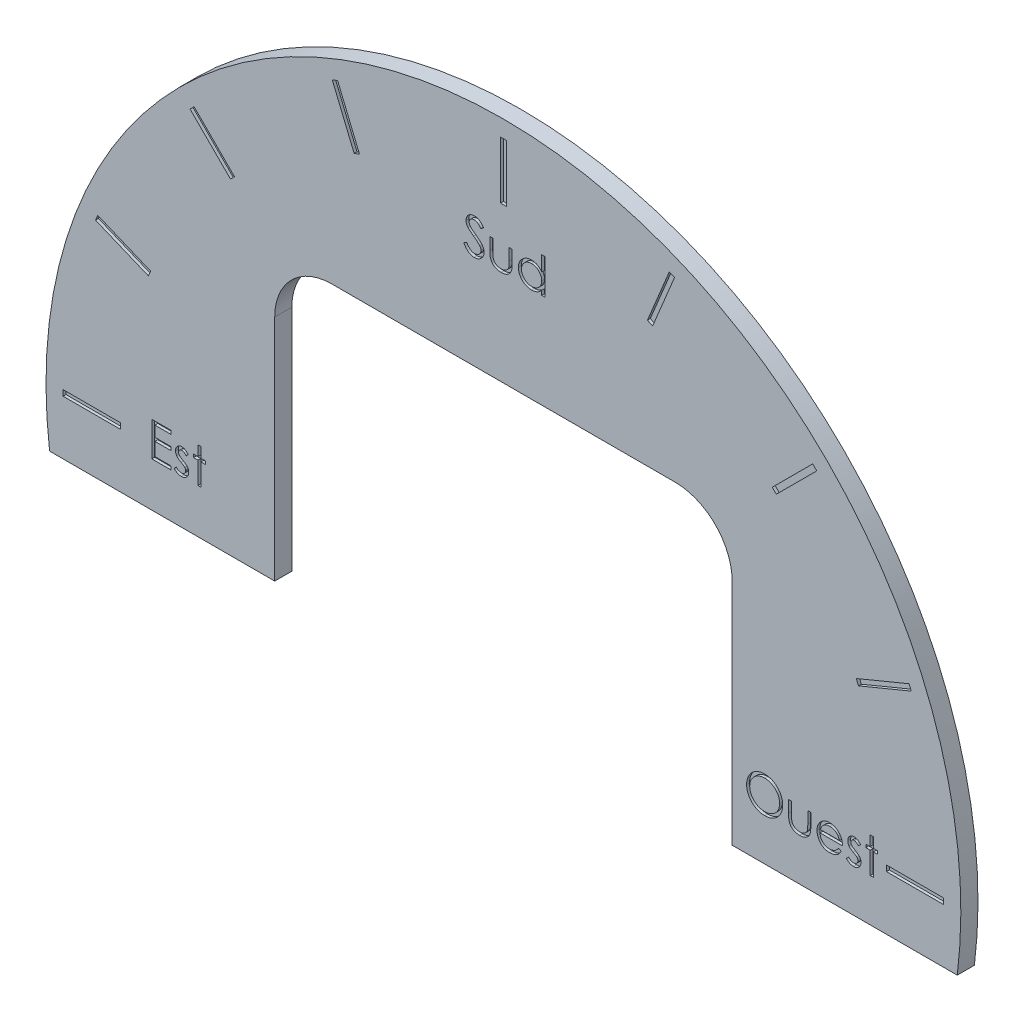
from build123d import *

# Parameters (mm, degrees)
BOSS_EXTRU_1_DEPTH      = 3
ESQUISSE2_W             = 10
ESQUISSE2_H             = 1
ESQUISSE2_W_2           = 1
ESQUISSE2_H_2           = 10
ENL_V_MAT_EXTRU_1_DEPTH = 0.5
ENL_V_MAT_EXTRU_2_DEPTH = 0.5


with BuildPart() as part:
    # Esquisse1 → Boss.-Extru.1 (new body)
    with BuildSketch(Plane.XY):
        with BuildLine():
            Line((-79.372539332, -10), (-40, -10))
            Line((-40, -10), (-40, 30))
            ThreePointArc((-40, 30), (-37.071067812, 37.071067812), (-30, 40))
            Line((-30, 40), (30, 40))
            ThreePointArc((30, 40), (37.071067812, 37.071067812), (40, 30))
            Line((40, 30), (40, -10))
            Line((40, -10), (79.372539332, -10))
            ThreePointArc((79.372539332, -10), (0, 80), (-79.372539332, -10))
        make_face()
    extrude(amount=BOSS_EXTRU_1_DEPTH)

    # Esquisse2 → Enlèv. mat.-Extru.1 (cut)
    with BuildSketch(Plane.XY.offset(3)):
        Polygon((-61.708586962, 26.101729735), (-62.091270394, 25.177850202), (-71.33006572, 29.004684526), (-70.947382287, 29.928564058), align=None)
        with Locations((-72, 0)):
            Rectangle(ESQUISSE2_W, ESQUISSE2_H)
        Polygon((-47.022600949, 47.72970773), (-47.72970773, 47.022600949), (-54.800775542, 54.093668761), (-54.093668761, 54.800775542), align=None)
        Polygon((-25.177850202, 62.091270394), (-26.101729735, 61.708586962), (-29.928564058, 70.947382287), (-29.004684526, 71.33006572), align=None)
        with Locations((0, 72)):
            Rectangle(ESQUISSE2_W_2, ESQUISSE2_H_2)
        Polygon((26.101729735, 61.708586962), (25.177850202, 62.091270394), (29.004684526, 71.33006572), (29.928564058, 70.947382287), align=None)
        Polygon((47.72970773, 47.022600949), (47.022600949, 47.72970773), (54.093668761, 54.800775542), (54.800775542, 54.093668761), align=None)
        Polygon((62.091270394, 25.177850202), (61.708586962, 26.101729735), (70.947382287, 29.928564058), (71.33006572, 29.004684526), align=None)
        with Locations((72, 0)):
            Rectangle(ESQUISSE2_W, ESQUISSE2_H)
    extrude(amount=-ENL_V_MAT_EXTRU_1_DEPTH, mode=Mode.SUBTRACT)

    # Esquisse3 → Enlèv. mat.-Extru.2 (cut)
    # profile 1 of 11: a face of its own
    with BuildSketch(Plane.XY.offset(3)):
        Polygon((-61.499492683, 3.764986314), (-58.114877298, 3.764986314), (-58.114877298, 3.149601699), (-60.961031144, 3.149601699), (-60.961031144, 1.303447853), (-58.114877298, 1.303447853), (-58.114877298, 0.688063237), (-60.961031144, 0.688063237), (-60.961031144, -1.61962907), (-58.114877298, -1.61962907), (-58.114877298, -2.235013686), (-61.499492683, -2.235013686), align=None)
    # profile 2 of 11: a face of its own
    with BuildSketch(Plane.XY.offset(3)):
        with BuildLine():
            Line((-55.114877298, 1.602726699), (-55.480261913, 1.226524776))
            add(Edge.make_bspline(
                [(-55.480261913, 1.226524776), (-55.511788491, 1.263061598), (-55.572568021, 1.33350029), (-55.668964845, 1.427678118), (-55.765005309, 1.506770014), (-55.859374703, 1.573545315), (-55.954446022, 1.624029566), (-56.049103596, 1.660877901), (-56.143445433, 1.683680996), (-56.206507208, 1.686620034), (-56.237473452, 1.688063237)],
                knots=[0, 0, 0, 0, 1.26578478, 2.440284043, 3.530471711, 4.527705817, 5.468200915, 6.346673037, 7.188140097, 8, 8, 8, 8], degree=3))
            add(Edge.make_bspline(
                [(-56.237473452, 1.688063237), (-56.275426692, 1.686220598), (-56.350113296, 1.682594544), (-56.457128985, 1.646400092), (-56.556472913, 1.590842255), (-56.642456307, 1.512038969), (-56.71529233, 1.421585937), (-56.768458641, 1.32044938), (-56.800971755, 1.211681305), (-56.805094153, 1.136201549), (-56.80718499, 1.097919007)],
                knots=[0, 0, 0, 0, 0.99966794, 1.967205029, 2.953328237, 3.988086729, 5.028030931, 6.008226631, 6.989793394, 8, 8, 8, 8], degree=3))
            add(Edge.make_bspline(
                [(-56.80718499, 1.097919007), (-56.805280741, 1.063269788), (-56.80147761, 0.994069027), (-56.771911874, 0.891986683), (-56.724827179, 0.792460332), (-56.680821131, 0.731495349), (-56.658146529, 0.700082468)],
                knots=[0, 0, 0, 0, 0.960159726, 1.917612774, 2.927026955, 4, 4, 4, 4], degree=3))
            add(Edge.make_bspline(
                [(-56.658146529, 0.700082468), (-56.644494825, 0.683308895), (-56.615438895, 0.647608459), (-56.560910012, 0.598058996), (-56.49915715, 0.543300851), (-56.424894399, 0.488551988), (-56.341321209, 0.430897602), (-56.246625293, 0.372608231), (-56.143811856, 0.309240645), (-56.070205044, 0.269050184), (-56.031944606, 0.248159391)],
                knots=[0, 0, 0, 0, 0.66740084, 1.420478572, 2.27185888, 3.217733974, 4.268547843, 5.408967954, 6.65319498, 8, 8, 8, 8], degree=3))
            add(Edge.make_bspline(
                [(-56.031944606, 0.248159391), (-55.985292759, 0.222025272), (-55.895176753, 0.171542759), (-55.76713201, 0.093183268), (-55.650925654, 0.015300826), (-55.54557308, -0.061271643), (-55.453101408, -0.138676559), (-55.370705032, -0.213947), (-55.300439128, -0.289357243), (-55.26108954, -0.34204258), (-55.242281144, -0.367225224)],
                knots=[0, 0, 0, 0, 1.27191281, 2.456916733, 3.569705269, 4.599008579, 5.553216877, 6.436649441, 7.252746552, 8, 8, 8, 8], degree=3))
            add(Edge.make_bspline(
                [(-55.242281144, -0.367225224), (-55.211063097, -0.418081375), (-55.14893339, -0.519294554), (-55.083690647, -0.685954716), (-55.045873033, -0.862715577), (-55.040623513, -0.983627954), (-55.037954221, -1.04510984)],
                knots=[0, 0, 0, 0, 0.995354457, 1.980940102, 2.973342416, 4, 4, 4, 4], degree=3))
            add(Edge.make_bspline(
                [(-55.037954221, -1.04510984), (-55.039187708, -1.088428376), (-55.041618428, -1.173792284), (-55.058517971, -1.299509135), (-55.087583645, -1.419739805), (-55.127172937, -1.535788865), (-55.180631862, -1.645432761), (-55.243285229, -1.751437759), (-55.318499363, -1.851510784), (-55.404370293, -1.94552043), (-55.498391139, -2.031381711), (-55.598687377, -2.106851346), (-55.705382515, -2.16955021), (-55.817714174, -2.221433659), (-55.935937581, -2.26269353), (-56.06007122, -2.291257869), (-56.189720514, -2.308354031), (-56.277885899, -2.310727419), (-56.32280999, -2.311936763)],
                knots=[0, 0, 0, 0, 1.032770009, 2.035186124, 3.017557409, 3.978232242, 4.952395191, 5.920591857, 6.910227898, 7.931268572, 8.952309245, 9.941945286, 10.918353717, 11.897095711, 12.887975737, 13.898235213, 14.929059601, 16, 16, 16, 16], degree=3))
            add(Edge.make_bspline(
                [(-56.32280999, -2.311936763), (-56.383439434, -2.310234991), (-56.50385588, -2.306855093), (-56.681952541, -2.275130416), (-56.855988128, -2.225766884), (-57.024645625, -2.157682425), (-57.184153249, -2.071709775), (-57.330091977, -1.968745671), (-57.46296877, -1.85219139), (-57.538600096, -1.762854972), (-57.57641576, -1.718186763)],
                knots=[0, 0, 0, 0, 1.013940152, 2.01379169, 3.017749504, 4.037548394, 5.051665909, 6.043208538, 7.021604269, 8, 8, 8, 8], degree=3))
            Line((-57.57641576, -1.718186763), (-57.219444606, -1.311936763))
            add(Edge.make_bspline(
                [(-57.219444606, -1.311936763), (-57.185549041, -1.34854493), (-57.119837362, -1.419515399), (-57.014749562, -1.514014269), (-56.907813446, -1.593216448), (-56.800096841, -1.659462302), (-56.69000525, -1.71050585), (-56.578155626, -1.746366297), (-56.46477547, -1.769413483), (-56.388623237, -1.77211911), (-56.350454221, -1.773475224)],
                knots=[0, 0, 0, 0, 1.179806542, 2.287233372, 3.337373186, 4.324005949, 5.273901747, 6.200048787, 7.097828587, 8, 8, 8, 8], degree=3))
            add(Edge.make_bspline(
                [(-56.350454221, -1.773475224), (-56.298480634, -1.771125239), (-56.196932962, -1.766533761), (-56.051486519, -1.724847318), (-55.917191731, -1.659481686), (-55.800580281, -1.566765061), (-55.701319434, -1.458841222), (-55.629442563, -1.33727416), (-55.584397691, -1.205631663), (-55.579107408, -1.114376287), (-55.57641576, -1.067946378)],
                knots=[0, 0, 0, 0, 1.072336372, 2.095165389, 3.102688358, 4.141489647, 5.156069229, 6.117746104, 7.042326257, 8, 8, 8, 8], degree=3))
            add(Edge.make_bspline(
                [(-55.57641576, -1.067946378), (-55.578277978, -1.029701317), (-55.58195468, -0.954191565), (-55.610828861, -0.844905266), (-55.656450893, -0.741243642), (-55.701373148, -0.680575675), (-55.724252298, -0.649677147)],
                knots=[0, 0, 0, 0, 1.013901739, 2.00181326, 2.98231254, 4, 4, 4, 4], degree=3))
            add(Edge.make_bspline(
                [(-55.724252298, -0.649677147), (-55.738004974, -0.634187955), (-55.76796327, -0.6004469), (-55.822915112, -0.551718194), (-55.88871259, -0.499195738), (-55.966095726, -0.443770157), (-56.055220518, -0.386172548), (-56.15644819, -0.326705087), (-56.268391995, -0.262543271), (-56.347541649, -0.21999529), (-56.38891576, -0.19775407)],
                knots=[0, 0, 0, 0, 0.615000592, 1.339693406, 2.178160186, 3.116406724, 4.166410947, 5.330106347, 6.604359322, 8, 8, 8, 8], degree=3))
            add(Edge.make_bspline(
                [(-56.38891576, -0.19775407), (-56.433567142, -0.172829845), (-56.520160424, -0.124493817), (-56.642812923, -0.049209108), (-56.75346553, 0.027363363), (-56.854780801, 0.10092823), (-56.944199667, 0.175364134), (-57.021369864, 0.250753708), (-57.089329663, 0.324056542), (-57.126953797, 0.375994764), (-57.144925375, 0.400803622)],
                knots=[0, 0, 0, 0, 1.262093308, 2.447601706, 3.550203992, 4.582594899, 5.537233252, 6.418365656, 7.244515135, 8, 8, 8, 8], degree=3))
            add(Edge.make_bspline(
                [(-57.144925375, 0.400803622), (-57.176006403, 0.450767533), (-57.23817932, 0.550712817), (-57.29854822, 0.717530777), (-57.340044269, 0.893150875), (-57.343751224, 1.01432834), (-57.345646529, 1.076284391)],
                knots=[0, 0, 0, 0, 0.985009483, 1.970363186, 2.962279964, 4, 4, 4, 4], degree=3))
            add(Edge.make_bspline(
                [(-57.345646529, 1.076284391), (-57.344730765, 1.116785073), (-57.342938487, 1.196050647), (-57.328634398, 1.312517196), (-57.302591465, 1.423171174), (-57.269925883, 1.529674367), (-57.224526447, 1.629963671), (-57.170276324, 1.725376479), (-57.106526453, 1.81578091), (-57.033080811, 1.899786279), (-56.952326562, 1.976087981), (-56.865078385, 2.042599915), (-56.773298517, 2.099353666), (-56.676598369, 2.146951084), (-56.574048987, 2.182953454), (-56.466367182, 2.207737543), (-56.353770916, 2.224289319), (-56.276797557, 2.225768892), (-56.237473452, 2.226524776)],
                knots=[0, 0, 0, 0, 1.087655834, 2.128696564, 3.144119009, 4.137814668, 5.115653402, 6.093965665, 7.082169637, 8.081268856, 9.086088321, 10.061021666, 11.022561449, 11.980240094, 12.950172527, 13.934149372, 14.944599409, 16, 16, 16, 16], degree=3))
            add(Edge.make_bspline(
                [(-56.237473452, 2.226524776), (-56.190858486, 2.22463162), (-56.096754106, 2.220809796), (-55.955574747, 2.190457183), (-55.814603303, 2.140514719), (-55.67347756, 2.071538319), (-55.53323135, 1.982280818), (-55.392631024, 1.874402019), (-55.249988687, 1.748611651), (-55.160920721, 1.65244155), (-55.114877298, 1.602726699)],
                knots=[0, 0, 0, 0, 0.845714091, 1.707292901, 2.609013841, 3.555613372, 4.552488639, 5.621697636, 6.770543573, 8, 8, 8, 8], degree=3))
        make_face()
    # profile 3 of 11: a face of its own
    with BuildSketch(Plane.XY.offset(3)):
        Polygon((-53.422569606, 3.918832468), (-52.884108067, 3.918832468), (-52.884108067, 2.149601699), (-52.114877298, 2.149601699), (-52.114877298, 1.61114016), (-52.884108067, 1.61114016), (-52.884108067, -2.235013686), (-53.422569606, -2.235013686), (-53.422569606, 1.61114016), (-54.191800375, 1.61114016), (-54.191800375, 2.149601699), (-53.422569606, 2.149601699), align=None)
    # profile 4 of 11: a face of its own
    with BuildSketch(Plane.XY.offset(3)):
        with BuildLine():
            add(Edge.make_bspline(
                [(45.650384869, 3.629438446), (45.761484479, 3.626624482), (45.979693279, 3.621097623), (46.300393104, 3.578790588), (46.606556124, 3.505598491), (46.900676362, 3.408119093), (47.179235751, 3.278083003), (47.444330995, 3.120908463), (47.69533135, 2.93494882), (47.928853719, 2.721641574), (48.142551348, 2.489555653), (48.330824296, 2.241879236), (48.488611085, 1.98010986), (48.61818672, 1.705034151), (48.719841479, 1.417274205), (48.789988411, 1.115295915), (48.834796669, 0.801055875), (48.840035144, 0.586724107), (48.842692561, 0.477996139)],
                knots=[0, 0, 0, 0, 1.065120563, 2.091984664, 3.0946048, 4.079830382, 5.057816894, 6.036188127, 7.030412546, 8.04752943, 9.064399622, 10.05169764, 11.02544977, 11.989514704, 12.962713494, 13.945757189, 14.957906945, 16, 16, 16, 16], degree=3))
            add(Edge.make_bspline(
                [(48.842692561, 0.477996139), (48.840035534, 0.370069088), (48.834798225, 0.157332367), (48.789937464, -0.154913537), (48.719581464, -0.455069017), (48.619130722, -0.742632993), (48.490172759, -1.017908817), (48.331335323, -1.280172166), (48.144236104, -1.529509021), (47.931310074, -1.763187875), (47.699194002, -1.977469254), (47.45022783, -2.164187326), (47.19001071, -2.324857254), (46.915194068, -2.453057838), (46.629422576, -2.555523987), (46.330138594, -2.625385639), (46.018744501, -2.670449142), (45.806394209, -2.67562374), (45.698461792, -2.678253861)],
                knots=[0, 0, 0, 0, 1.043624062, 2.057103931, 3.04512605, 4.022047818, 4.998200453, 5.980619268, 6.982898556, 8.009068085, 9.034988726, 10.034168286, 11.015286542, 11.987931943, 12.962482838, 13.94673481, 14.956375938, 16, 16, 16, 16], degree=3))
            add(Edge.make_bspline(
                [(45.698461792, -2.678253861), (45.589734388, -2.67559777), (45.375403732, -2.670361906), (45.060768814, -2.625479497), (44.758578396, -2.555294405), (44.469696651, -2.454992515), (44.193962486, -2.325362976), (43.93083663, -2.167298326), (43.681375235, -1.979743227), (43.447646527, -1.766886242), (43.233790758, -1.535163582), (43.047346114, -1.286876287), (42.88924592, -1.026895504), (42.760051636, -0.754499749), (42.657769705, -0.471005847), (42.587990017, -0.174522743), (42.542842671, 0.133259267), (42.537640077, 0.342818522), (42.535000253, 0.449149985)],
                knots=[0, 0, 0, 0, 1.053102029, 2.075944431, 3.073151272, 4.055350789, 5.033113405, 6.020478099, 7.024410459, 8.052272461, 9.079885166, 10.07527673, 11.055994387, 12.023226415, 12.992069828, 13.970394897, 14.97016774, 16, 16, 16, 16], degree=3))
            add(Edge.make_bspline(
                [(42.535000253, 0.449149985), (42.535916771, 0.520520275), (42.537738245, 0.662360486), (42.559666861, 0.872988944), (42.59148692, 1.080230071), (42.637090199, 1.283494554), (42.696733056, 1.482284813), (42.76710796, 1.677971835), (42.853061981, 1.868572504), (42.950228806, 2.054989747), (43.05867762, 2.234317586), (43.178464619, 2.403825443), (43.305382394, 2.564935723), (43.44451964, 2.713473444), (43.591290689, 2.853759712), (43.74807648, 2.983638655), (43.913920327, 3.104281429), (44.089535835, 3.213002013), (44.270595735, 3.311331958), (44.45724164, 3.395712274), (44.64693862, 3.468134094), (44.840575159, 3.526832651), (45.037637054, 3.573173285), (45.238554399, 3.604728748), (45.44316713, 3.626713293), (45.581015105, 3.628526154), (45.650384869, 3.629438446)],
                knots=[0, 0, 0, 0, 1.037015668, 2.060948919, 3.074880161, 4.083647147, 5.086022904, 6.090072063, 7.104153813, 8.122640571, 9.144368836, 10.147691507, 11.138137339, 12.123020368, 13.103399296, 14.087645067, 15.080126199, 16.082011238, 17.087798457, 18.072939717, 19.057185487, 20.037253025, 21.01195951, 21.997135196, 22.992090687, 24, 24, 24, 24], degree=3))
        make_face()
        with BuildLine():
            add(Edge.make_bspline(
                [(45.676827176, 3.014053831), (45.619887805, 3.013359733), (45.506553405, 3.011978174), (45.338065629, 2.993779804), (45.171793742, 2.967842852), (45.007703407, 2.930845959), (44.846481197, 2.880439011), (44.686624326, 2.822426026), (44.52959052, 2.751761299), (44.375898192, 2.671922377), (44.22690092, 2.583552799), (44.086307718, 2.485886913), (43.953754614, 2.381215105), (43.829566157, 2.269293098), (43.714107004, 2.149550924), (43.605104659, 2.023803891), (43.506928233, 1.888457792), (43.416952959, 1.747182808), (43.336436661, 1.600162955), (43.26483891, 1.448946048), (43.206272038, 1.292298585), (43.158507964, 1.131920029), (43.118908289, 0.968064384), (43.093821561, 0.799488643), (43.075423231, 0.62703988), (43.074120639, 0.510499559), (43.073461792, 0.451553831)],
                knots=[0, 0, 0, 0, 1.008559885, 2.007477868, 2.99961109, 3.989939068, 4.984837346, 5.991145699, 7.001802488, 8.033829008, 9.059044045, 10.069351652, 11.065060232, 12.050310815, 13.029377138, 14.011219647, 14.996725999, 15.989392538, 16.977580475, 17.965360261, 18.951710183, 19.937753436, 20.929683414, 21.935841486, 22.955955122, 24, 24, 24, 24], degree=3))
            add(Edge.make_bspline(
                [(43.073461792, 0.451553831), (43.075647269, 0.364875738), (43.07994678, 0.194353115), (43.117588329, -0.055535132), (43.175568856, -0.29568648), (43.261038627, -0.524786896), (43.367925395, -0.744805666), (43.499971493, -0.953790989), (43.65641564, -1.151799345), (43.834124543, -1.337448377), (44.02839204, -1.506898327), (44.234676719, -1.655635599), (44.450768618, -1.781481742), (44.677231251, -1.884004723), (44.912855604, -1.965244274), (45.159159977, -2.020921927), (45.414503622, -2.057565565), (45.588556174, -2.061084575), (45.676827176, -2.062869246)],
                knots=[0, 0, 0, 0, 1.032063989, 2.030389145, 3.003944642, 3.970395727, 4.937377036, 5.913328081, 6.909231446, 7.93887556, 8.970685674, 9.976071282, 10.964166581, 11.944589148, 12.933237628, 13.927779006, 14.949070134, 16, 16, 16, 16], degree=3))
            add(Edge.make_bspline(
                [(45.676827176, -2.062869246), (45.736157751, -2.062054096), (45.853828099, -2.060437408), (46.028848994, -2.044153962), (46.200716786, -2.018042186), (46.369190408, -1.980446776), (46.534078656, -1.933394422), (46.696069747, -1.87749546), (46.853438245, -1.807756254), (47.008169396, -1.730702622), (47.156277239, -1.642862352), (47.297663865, -1.548511238), (47.428765545, -1.443993603), (47.552861096, -1.333734496), (47.668794277, -1.215510757), (47.775781107, -1.089476091), (47.873461334, -0.954834964), (47.963402442, -0.813774268), (48.043636607, -0.666352121), (48.113543634, -0.514586959), (48.172851261, -0.358852485), (48.220728698, -0.198924077), (48.258246632, -0.035105479), (48.284097924, 0.132822655), (48.302180961, 0.304524385), (48.303543951, 0.420656709), (48.304231023, 0.479198062)],
                knots=[0, 0, 0, 0, 1.047197238, 2.076906641, 3.100256066, 4.114471768, 5.12198147, 6.126382909, 7.136867548, 8.15857795, 9.17633901, 10.174870724, 11.156907918, 12.133735059, 13.104061851, 14.077631395, 15.04955518, 16.038496417, 17.029181396, 18.010275684, 18.986308667, 19.968651475, 20.955262928, 21.950658345, 22.966943676, 24, 24, 24, 24], degree=3))
            add(Edge.make_bspline(
                [(48.304231023, 0.479198062), (48.3035434, 0.537338926), (48.302179375, 0.652672041), (48.284106561, 0.823176301), (48.258219321, 0.989896092), (48.220911821, 1.152176897), (48.172825843, 1.310060083), (48.113533277, 1.463397365), (48.043615621, 1.612759985), (47.96337295, 1.75777878), (47.873174396, 1.896935473), (47.774612836, 2.029968181), (47.665986525, 2.154378594), (47.550399053, 2.27323807), (47.42496325, 2.384011595), (47.290247317, 2.486735916), (47.147886727, 2.5838901), (46.997154323, 2.671533921), (46.84159326, 2.752472605), (46.681969332, 2.821817182), (46.520090875, 2.880740815), (46.35636954, 2.93099847), (46.189427291, 2.96769795), (46.020392156, 2.993803178), (45.849497999, 3.01197184), (45.734566765, 3.013357632), (45.676827176, 3.014053831)],
                knots=[0, 0, 0, 0, 1.02996197, 2.043119294, 3.035359645, 4.018872909, 4.991431989, 5.957985074, 6.929999688, 7.912076566, 8.892894881, 9.867085534, 10.843653904, 11.817741046, 12.803660682, 13.806313499, 14.818574707, 15.856120519, 16.894564902, 17.924820532, 18.937903209, 19.946497019, 20.957711757, 21.963978472, 22.977135795, 24, 24, 24, 24], degree=3))
        make_face(mode=Mode.SUBTRACT)
    # profile 5 of 11: a face of its own
    with BuildSketch(Plane.XY.offset(3)):
        with BuildLine():
            Line((49.842692561, 1.860207677), (50.381154099, 1.860207677))
            Line((50.381154099, 1.860207677), (50.381154099, -0.173446169))
            add(Edge.make_bspline(
                [(50.381154099, -0.173446169), (50.381397365, -0.23314231), (50.381862721, -0.347338233), (50.385018619, -0.51166141), (50.392441637, -0.661518632), (50.401722479, -0.796996466), (50.413657569, -0.918071995), (50.427857616, -1.024322321), (50.443729196, -1.116952351), (50.459265277, -1.172740961), (50.466490638, -1.198686554)],
                knots=[0, 0, 0, 0, 1.388932606, 2.656963016, 3.823490214, 4.879454478, 5.816252168, 6.653371382, 7.373723809, 8, 8, 8, 8], degree=3))
            add(Edge.make_bspline(
                [(50.466490638, -1.198686554), (50.478081704, -1.23129719), (50.50102286, -1.295840494), (50.542634546, -1.389078789), (50.594111695, -1.475436416), (50.650442828, -1.558243398), (50.715413241, -1.635046804), (50.788200906, -1.705716936), (50.866369312, -1.772923949), (50.982520781, -1.852440736), (51.141365237, -1.937667016), (51.349912817, -2.011202705), (51.576034347, -2.055149825), (51.732316723, -2.060248547), (51.812644484, -2.062869246)],
                knots=[0, 0, 0, 0, 0.725840625, 1.436591201, 2.137033971, 2.831655856, 3.53531722, 4.242432219, 4.957935707, 5.694543706, 7.190802206, 8.724350549, 10.316345118, 12, 12, 12, 12], degree=3))
            add(Edge.make_bspline(
                [(51.812644484, -2.062869246), (51.892964783, -2.06019282), (52.0483697, -2.05501443), (52.27200679, -2.012528364), (52.476437786, -1.941547183), (52.659610846, -1.842448763), (52.820695143, -1.721176655), (52.95493129, -1.57887584), (53.065686583, -1.42004832), (53.11404559, -1.301549556), (53.138365638, -1.241955784)],
                knots=[0, 0, 0, 0, 1.157059328, 2.238695713, 3.266970494, 4.264342957, 5.228770407, 6.160125903, 7.074715775, 8, 8, 8, 8], degree=3))
            add(Edge.make_bspline(
                [(53.138365638, -1.241955784), (53.145555747, -1.218013558), (53.161451321, -1.165083143), (53.178529638, -1.075289289), (53.193914429, -0.96820711), (53.207051302, -0.843135895), (53.216420153, -0.70040249), (53.221470484, -0.540051503), (53.227176099, -0.362586314), (53.227262698, -0.238355869), (53.227307946, -0.173446169)],
                knots=[0, 0, 0, 0, 0.557542046, 1.232589297, 2.036731608, 2.971723315, 4.038036528, 5.22795436, 6.551621927, 8, 8, 8, 8], degree=3))
            Line((53.227307946, -0.173446169), (53.227307946, 1.860207677))
            Line((53.227307946, 1.860207677), (53.765769484, 1.860207677))
            Line((53.765769484, 1.860207677), (53.765769484, -0.274407708))
            add(Edge.make_bspline(
                [(53.765769484, -0.274407708), (53.765012293, -0.346934287), (53.763543239, -0.487645773), (53.754102078, -0.692132821), (53.737902742, -0.882696669), (53.713315282, -1.059438189), (53.684402697, -1.222222443), (53.647106229, -1.371258065), (53.602572108, -1.506085872), (53.552334082, -1.629071775), (53.492982309, -1.740580737), (53.429850274, -1.846413565), (53.356950665, -1.943944311), (53.280201692, -2.038027975), (53.194827425, -2.123984879), (53.102427667, -2.203787409), (53.004302947, -2.278655464), (52.89827575, -2.345669085), (52.785893928, -2.406040477), (52.667018745, -2.459553754), (52.540194176, -2.501901029), (52.407056513, -2.538433599), (52.266953463, -2.567086975), (52.120020092, -2.587292518), (51.966305892, -2.599678799), (51.861546819, -2.600770876), (51.807836792, -2.601330784)],
                knots=[0, 0, 0, 0, 1.493040784, 2.896703357, 4.213163133, 5.428574705, 6.569057535, 7.615249723, 8.588095153, 9.490268104, 10.346124644, 11.18633936, 12.024365274, 12.850166724, 13.684164916, 14.514361689, 15.362232829, 16.222528818, 17.093394965, 17.986930858, 18.902426812, 19.842810585, 20.827885679, 21.843828298, 22.894529745, 24, 24, 24, 24], degree=3))
            add(Edge.make_bspline(
                [(51.807836792, -2.601330784), (51.754528482, -2.600748429), (51.64977269, -2.599604047), (51.496050557, -2.587360948), (51.348710089, -2.56711837), (51.20827512, -2.538223712), (51.074604725, -2.502156735), (50.947157457, -2.459293531), (50.827425634, -2.406012705), (50.71397077, -2.346051178), (50.607680962, -2.278224992), (50.508066257, -2.203879781), (50.415260224, -2.12312653), (50.329242393, -2.036302489), (50.251220147, -1.942330598), (50.180221219, -1.841966781), (50.115152581, -1.736205486), (50.056262084, -1.62295435), (50.005670503, -1.498545191), (49.961004367, -1.360893024), (49.924471844, -1.20848871), (49.894741898, -1.041462547), (49.870825143, -0.860613904), (49.854220328, -0.66489662), (49.844936046, -0.454787434), (49.843456512, -0.309673337), (49.842692561, -0.234744246)],
                knots=[0, 0, 0, 0, 1.083640291, 2.129454052, 3.13281866, 4.105697902, 5.042300162, 5.946461698, 6.836384745, 7.703652036, 8.553297018, 9.397182691, 10.228592656, 11.052265423, 11.879314572, 12.708807002, 13.549817954, 14.402308542, 15.300838682, 16.27712199, 17.341985831, 18.484375296, 19.725102775, 21.0496083, 22.476576903, 24, 24, 24, 24], degree=3))
            Line((49.842692561, -0.234744246), (49.842692561, 1.860207677))
        make_face()
    # profile 6 of 11: a face of its own
    with BuildSketch(Plane.XY.offset(3)):
        with BuildLine():
            Line((58.595096407, -1.139792323), (59.073461792, -1.390994246))
            add(Edge.make_bspline(
                [(59.073461792, -1.390994246), (59.035341914, -1.458611385), (58.961175728, -1.590167562), (58.833631589, -1.770907894), (58.699930893, -1.933503978), (58.554038377, -2.073611957), (58.400318927, -2.195757188), (58.23792009, -2.302622031), (58.065996403, -2.393682351), (57.884539732, -2.47040097), (57.692026215, -2.529388675), (57.48798933, -2.571053053), (57.272038195, -2.596807228), (57.124016172, -2.599798898), (57.048221407, -2.601330784)],
                knots=[0, 0, 0, 0, 1.120438281, 2.179929193, 3.190490725, 4.156257408, 5.095198341, 6.022838206, 6.959905092, 7.901321166, 8.864066838, 9.862729781, 10.905609505, 12, 12, 12, 12], degree=3))
            add(Edge.make_bspline(
                [(57.048221407, -2.601330784), (56.963978017, -2.599364198), (56.799643569, -2.595527958), (56.560432573, -2.562455162), (56.335210713, -2.508502547), (56.12399065, -2.433133047), (55.927289646, -2.334686206), (55.744716752, -2.214755666), (55.575311851, -2.073957515), (55.424413206, -1.911072183), (55.28856655, -1.736760256), (55.168693716, -1.555121597), (55.068480977, -1.366613212), (54.986962217, -1.172435171), (54.921125305, -0.973811354), (54.875239527, -0.768934552), (54.848788531, -0.558359265), (54.844735196, -0.415906689), (54.842692561, -0.344119246)],
                knots=[0, 0, 0, 0, 1.145258523, 2.234067595, 3.276747158, 4.290159414, 5.277019952, 6.260822364, 7.254936242, 8.264827045, 9.274100331, 10.257902744, 11.220704747, 12.172965371, 13.118907548, 14.062713208, 15.023725156, 16, 16, 16, 16], degree=3))
            add(Edge.make_bspline(
                [(54.842692561, -0.344119246), (54.844508232, -0.27675668), (54.848106652, -0.143252969), (54.870788002, 0.054345108), (54.910985075, 0.246393883), (54.966144488, 0.433052937), (55.037375196, 0.614009738), (55.124516143, 0.789374419), (55.227703076, 0.958960373), (55.307370517, 1.065937173), (55.347500253, 1.119823062)],
                knots=[0, 0, 0, 0, 1.024358464, 2.0301432, 3.019427413, 4.004406732, 4.986367066, 5.972626655, 6.978780325, 8, 8, 8, 8], degree=3))
            add(Edge.make_bspline(
                [(55.347500253, 1.119823062), (55.401856281, 1.184741125), (55.508846475, 1.312520811), (55.689800227, 1.480415084), (55.885743421, 1.621061556), (56.094220494, 1.737645218), (56.31765445, 1.826228613), (56.553041806, 1.892241611), (56.803062811, 1.929232487), (56.973986046, 1.934457344), (57.061442561, 1.937130754)],
                knots=[0, 0, 0, 0, 1.030682036, 2.02871468, 2.997146059, 3.962720338, 4.930598197, 5.918074684, 6.934738563, 8, 8, 8, 8], degree=3))
            add(Edge.make_bspline(
                [(57.061442561, 1.937130754), (57.151352742, 1.934809527), (57.32773602, 1.93025581), (57.584933942, 1.888039238), (57.82829517, 1.821092002), (58.057722321, 1.726542647), (58.273238653, 1.604554844), (58.47344331, 1.453454544), (58.661760188, 1.27788068), (58.771317752, 1.142858035), (58.827067561, 1.074149985)],
                knots=[0, 0, 0, 0, 1.056321875, 2.072262726, 3.055038591, 4.01806755, 4.982017516, 5.957941055, 6.960871419, 8, 8, 8, 8], degree=3))
            add(Edge.make_bspline(
                [(58.827067561, 1.074149985), (58.864999455, 1.022372417), (58.940610758, 0.919161928), (59.035320072, 0.750868515), (59.117532749, 0.574793211), (59.183246397, 0.388089844), (59.23645697, 0.192970564), (59.274954374, -0.011959513), (59.297530863, -0.226639361), (59.30196863, -0.372913456), (59.304231023, -0.447484631)],
                knots=[0, 0, 0, 0, 0.94817472, 1.890038105, 2.849395472, 3.817997239, 4.812318967, 5.836947057, 6.897266129, 8, 8, 8, 8], degree=3))
            Line((59.304231023, -0.447484631), (55.381154099, -0.447484631))
            add(Edge.make_bspline(
                [(55.381154099, -0.447484631), (55.383793425, -0.505256855), (55.388983552, -0.618863604), (55.41318094, -0.785099232), (55.451321695, -0.943453533), (55.504925802, -1.092738748), (55.569840394, -1.234904681), (55.649358766, -1.368896744), (55.744226573, -1.494104624), (55.850042057, -1.611648289), (55.967825649, -1.716323879), (56.09173893, -1.810012639), (56.22355647, -1.888536519), (56.362238899, -1.952273473), (56.507561959, -2.002170015), (56.659571437, -2.036229136), (56.817968207, -2.059041319), (56.925943752, -2.061577888), (56.980913715, -2.062869246)],
                knots=[0, 0, 0, 0, 1.094153842, 2.151609401, 3.174256925, 4.172055639, 5.149267565, 6.128595816, 7.11444997, 8.118368179, 9.117203808, 10.09244225, 11.054858984, 12.015122123, 12.976791628, 13.957293641, 14.960065497, 16, 16, 16, 16], degree=3))
            add(Edge.make_bspline(
                [(56.980913715, -2.062869246), (57.034658539, -2.061826863), (57.141298581, -2.059758576), (57.300111479, -2.039646728), (57.456350669, -2.007126256), (57.609369497, -1.962743416), (57.756062376, -1.908611669), (57.891911891, -1.843292485), (58.016849403, -1.771035776), (58.133621346, -1.688390619), (58.246885906, -1.587233727), (58.359244454, -1.461001062), (58.479718717, -1.311708157), (58.555129447, -1.199344159), (58.595096407, -1.139792323)],
                knots=[0, 0, 0, 0, 0.99110716, 1.966546729, 2.947904876, 3.932708344, 4.903319531, 5.828989031, 6.710028674, 7.56322171, 8.463672341, 9.504779593, 10.677557249, 12, 12, 12, 12], degree=3))
        make_face()
        with BuildLine():
            add(Edge.make_bspline(
                [(58.765769484, 0.090976908), (58.746060985, 0.162398977), (58.708128468, 0.29986347), (58.628866129, 0.490219282), (58.539600631, 0.659398541), (58.433963377, 0.806106483), (58.314274133, 0.93639822), (58.176025248, 1.050258651), (58.020992288, 1.152117139), (57.849976618, 1.238092852), (57.668876415, 1.311275467), (57.479265801, 1.360347094), (57.285795307, 1.393963452), (57.15493653, 1.397093924), (57.089086792, 1.398669216)],
                knots=[0, 0, 0, 0, 1.154881502, 2.222775134, 3.210006277, 4.132804581, 5.035138423, 5.962687519, 6.919655026, 7.923214229, 8.944639381, 9.960483929, 10.97369054, 12, 12, 12, 12], degree=3))
            add(Edge.make_bspline(
                [(57.089086792, 1.398669216), (57.035344897, 1.397620636), (56.92910847, 1.395547814), (56.772592353, 1.375884735), (56.622284298, 1.343382144), (56.477075234, 1.29887079), (56.338868031, 1.239541757), (56.204819857, 1.169970511), (56.078339177, 1.085042082), (55.999239814, 1.020312616), (55.959279099, 0.987611523)],
                knots=[0, 0, 0, 0, 1.04873581, 2.073130211, 3.073294108, 4.04793562, 5.032784715, 6.005352987, 6.992311501, 8, 8, 8, 8], degree=3))
            add(Edge.make_bspline(
                [(55.959279099, 0.987611523), (55.930662045, 0.961735554), (55.8727481, 0.909368898), (55.795364349, 0.819147401), (55.72127211, 0.721859008), (55.653842991, 0.613781652), (55.5919957, 0.496146031), (55.534121454, 0.36994437), (55.482030461, 0.234219004), (55.452722844, 0.13963768), (55.437644484, 0.090976908)],
                knots=[0, 0, 0, 0, 0.879870761, 1.780643979, 2.707998968, 3.669668524, 4.684282772, 5.740141944, 6.837334558, 8, 8, 8, 8], degree=3))
            Line((55.437644484, 0.090976908), (58.765769484, 0.090976908))
        make_face(mode=Mode.SUBTRACT)
    # profile 7 of 11: a face of its own
    with BuildSketch(Plane.XY.offset(3)):
        with BuildLine():
            Line((62.458077176, 1.313332677), (62.092692561, 0.937130754))
            add(Edge.make_bspline(
                [(62.092692561, 0.937130754), (62.061165984, 0.973667576), (62.000386454, 1.044106268), (61.903989629, 1.138284097), (61.807949166, 1.217375992), (61.713579771, 1.284151293), (61.618508453, 1.334635544), (61.523850879, 1.371483879), (61.429509041, 1.394286975), (61.366447267, 1.397226012), (61.335481023, 1.398669216)],
                knots=[0, 0, 0, 0, 1.26578478, 2.440284043, 3.530471711, 4.527705817, 5.468200915, 6.346673037, 7.188140097, 8, 8, 8, 8], degree=3))
            add(Edge.make_bspline(
                [(61.335481023, 1.398669216), (61.297527783, 1.396826576), (61.222841178, 1.393200523), (61.11582549, 1.357006071), (61.016481561, 1.301448233), (60.930498167, 1.222644947), (60.857662144, 1.132191915), (60.804495834, 1.031055358), (60.771982719, 0.922287283), (60.767860321, 0.846807527), (60.765769484, 0.808524985)],
                knots=[0, 0, 0, 0, 0.99966794, 1.967205029, 2.953328237, 3.988086729, 5.028030931, 6.008226631, 6.989793394, 8, 8, 8, 8], degree=3))
            add(Edge.make_bspline(
                [(60.765769484, 0.808524985), (60.767673734, 0.773875766), (60.771476865, 0.704675005), (60.801042601, 0.602592661), (60.848127296, 0.50306631), (60.892133343, 0.442101328), (60.914807946, 0.410688446)],
                knots=[0, 0, 0, 0, 0.960159726, 1.917612774, 2.927026955, 4, 4, 4, 4], degree=3))
            add(Edge.make_bspline(
                [(60.914807946, 0.410688446), (60.928459649, 0.393914873), (60.95751558, 0.358214437), (61.012044463, 0.308664974), (61.073797325, 0.253906829), (61.148060075, 0.199157966), (61.231633266, 0.14150358), (61.326329181, 0.083214209), (61.429142619, 0.019846623), (61.50274943, -0.020343837), (61.541009869, -0.041234631)],
                knots=[0, 0, 0, 0, 0.66740084, 1.420478572, 2.27185888, 3.217733974, 4.268547843, 5.408967954, 6.65319498, 8, 8, 8, 8], degree=3))
            add(Edge.make_bspline(
                [(61.541009869, -0.041234631), (61.587661715, -0.06736875), (61.677777721, -0.117851262), (61.805822465, -0.196210754), (61.922028821, -0.274093196), (62.027381394, -0.350665665), (62.119853066, -0.428070581), (62.202249442, -0.503341022), (62.272515346, -0.578751264), (62.311864935, -0.631436602), (62.33067333, -0.656619246)],
                knots=[0, 0, 0, 0, 1.27191281, 2.456916733, 3.569705269, 4.599008579, 5.553216877, 6.436649441, 7.252746552, 8, 8, 8, 8], degree=3))
            add(Edge.make_bspline(
                [(62.33067333, -0.656619246), (62.361891377, -0.707475397), (62.424021085, -0.808688576), (62.489263827, -0.975348737), (62.527081441, -1.152109599), (62.532330962, -1.273021976), (62.535000253, -1.334503861)],
                knots=[0, 0, 0, 0, 0.995354457, 1.980940102, 2.973342416, 4, 4, 4, 4], degree=3))
            add(Edge.make_bspline(
                [(62.535000253, -1.334503861), (62.533766767, -1.377822398), (62.531336047, -1.463186306), (62.514436503, -1.588903157), (62.48537083, -1.709133827), (62.445781537, -1.825182886), (62.392322612, -1.934826783), (62.329669246, -2.040831781), (62.254455111, -2.140904805), (62.168584182, -2.234914451), (62.074563335, -2.320775733), (61.974267098, -2.396245368), (61.86757196, -2.458944232), (61.7552403, -2.510827681), (61.637016893, -2.552087551), (61.512883254, -2.580651891), (61.383233961, -2.597748053), (61.295068575, -2.60012144), (61.250144484, -2.601330784)],
                knots=[0, 0, 0, 0, 1.032770009, 2.035186124, 3.017557409, 3.978232242, 4.952395191, 5.920591857, 6.910227898, 7.931268572, 8.952309245, 9.941945286, 10.918353717, 11.897095711, 12.887975737, 13.898235213, 14.929059601, 16, 16, 16, 16], degree=3))
            add(Edge.make_bspline(
                [(61.250144484, -2.601330784), (61.18951504, -2.599629012), (61.069098594, -2.596249114), (60.891001933, -2.564524438), (60.716966347, -2.515160906), (60.548308849, -2.447076447), (60.388801225, -2.361103796), (60.242862497, -2.258139693), (60.109985704, -2.141585412), (60.034354378, -2.052248994), (59.996538715, -2.007580784)],
                knots=[0, 0, 0, 0, 1.013940152, 2.01379169, 3.017749504, 4.037548394, 5.051665909, 6.043208538, 7.021604269, 8, 8, 8, 8], degree=3))
            Line((59.996538715, -2.007580784), (60.353509869, -1.601330784))
            add(Edge.make_bspline(
                [(60.353509869, -1.601330784), (60.387405434, -1.637938952), (60.453117112, -1.708909421), (60.558204912, -1.80340829), (60.665141028, -1.882610469), (60.772857634, -1.948856323), (60.882949224, -1.999899872), (60.994798848, -2.035760318), (61.108179004, -2.058807505), (61.184331237, -2.061513132), (61.222500253, -2.062869246)],
                knots=[0, 0, 0, 0, 1.179806542, 2.287233372, 3.337373186, 4.324005949, 5.273901747, 6.200048787, 7.097828587, 8, 8, 8, 8], degree=3))
            add(Edge.make_bspline(
                [(61.222500253, -2.062869246), (61.274473841, -2.06051926), (61.376021512, -2.055927783), (61.521467955, -2.01424134), (61.655762743, -1.948875708), (61.772374193, -1.856159082), (61.87163504, -1.748235244), (61.943511911, -1.626668182), (61.988556783, -1.495025685), (61.993847067, -1.403770309), (61.996538715, -1.3573404)],
                knots=[0, 0, 0, 0, 1.072336372, 2.095165389, 3.102688358, 4.141489647, 5.156069229, 6.117746104, 7.042326257, 8, 8, 8, 8], degree=3))
            add(Edge.make_bspline(
                [(61.996538715, -1.3573404), (61.994676496, -1.319095339), (61.990999794, -1.243585587), (61.962125614, -1.134299288), (61.916503581, -1.030637664), (61.871581327, -0.969969697), (61.848702176, -0.939071169)],
                knots=[0, 0, 0, 0, 1.013901739, 2.00181326, 2.98231254, 4, 4, 4, 4], degree=3))
            add(Edge.make_bspline(
                [(61.848702176, -0.939071169), (61.8349495, -0.923581977), (61.804991205, -0.889840922), (61.750039362, -0.841112215), (61.684241884, -0.78858976), (61.606858748, -0.733164179), (61.517733956, -0.675566569), (61.416506284, -0.616099108), (61.30456248, -0.551937293), (61.225412826, -0.509389312), (61.184038715, -0.487148092)],
                knots=[0, 0, 0, 0, 0.615000592, 1.339693406, 2.178160186, 3.116406724, 4.166410947, 5.330106347, 6.604359322, 8, 8, 8, 8], degree=3))
            add(Edge.make_bspline(
                [(61.184038715, -0.487148092), (61.139387332, -0.462223866), (61.052794051, -0.413887839), (60.930141552, -0.338603129), (60.819488945, -0.262030659), (60.718173674, -0.188465791), (60.628754807, -0.114029887), (60.55158461, -0.038640313), (60.483624811, 0.03466252), (60.446000677, 0.086600743), (60.428029099, 0.1114096)],
                knots=[0, 0, 0, 0, 1.262093308, 2.447601706, 3.550203992, 4.582594899, 5.537233252, 6.418365656, 7.244515135, 8, 8, 8, 8], degree=3))
            add(Edge.make_bspline(
                [(60.428029099, 0.1114096), (60.396948071, 0.161373512), (60.334775154, 0.261318795), (60.274406255, 0.428136755), (60.232910205, 0.603756853), (60.229203251, 0.724934318), (60.227307946, 0.786890369)],
                knots=[0, 0, 0, 0, 0.985009483, 1.970363186, 2.962279964, 4, 4, 4, 4], degree=3))
            add(Edge.make_bspline(
                [(60.227307946, 0.786890369), (60.228223709, 0.827391052), (60.230015988, 0.906656625), (60.244320076, 1.023123174), (60.27036301, 1.133777152), (60.303028591, 1.240280346), (60.348428027, 1.34056965), (60.402678151, 1.435982457), (60.466428022, 1.526386888), (60.539873663, 1.610392257), (60.620627912, 1.68669396), (60.707876089, 1.753205893), (60.799655957, 1.809959644), (60.896356105, 1.857557062), (60.998905487, 1.893559433), (61.106587293, 1.918343521), (61.219183558, 1.934895298), (61.296156917, 1.936374871), (61.335481023, 1.937130754)],
                knots=[0, 0, 0, 0, 1.087655834, 2.128696564, 3.144119009, 4.137814668, 5.115653402, 6.093965665, 7.082169637, 8.081268856, 9.086088321, 10.061021666, 11.022561449, 11.980240094, 12.950172527, 13.934149372, 14.944599409, 16, 16, 16, 16], degree=3))
            add(Edge.make_bspline(
                [(61.335481023, 1.937130754), (61.382095988, 1.935237599), (61.476200369, 1.931415774), (61.617379728, 1.901063161), (61.758351171, 1.851120697), (61.899476914, 1.782144297), (62.039723124, 1.692886796), (62.18032345, 1.585007997), (62.322965788, 1.459217629), (62.412033753, 1.363047528), (62.458077176, 1.313332677)],
                knots=[0, 0, 0, 0, 0.845714091, 1.707292901, 2.609013841, 3.555613372, 4.552488639, 5.621697636, 6.770543573, 8, 8, 8, 8], degree=3))
        make_face()
    # profile 8 of 11: a face of its own
    with BuildSketch(Plane.XY.offset(3)):
        Polygon((64.150384869, 3.629438446), (64.688846407, 3.629438446), (64.688846407, 1.860207677), (65.458077176, 1.860207677), (65.458077176, 1.321746139), (64.688846407, 1.321746139), (64.688846407, -2.524407708), (64.150384869, -2.524407708), (64.150384869, 1.321746139), (63.381154099, 1.321746139), (63.381154099, 1.860207677), (64.150384869, 1.860207677), align=None)
    # profile 9 of 11: a face of its own
    with BuildSketch(Plane.XY.offset(3)):
        with BuildLine():
            Line((-6.92047445, 57.788689985), (-6.413262911, 58.092776523))
            add(Edge.make_bspline(
                [(-6.413262911, 58.092776523), (-6.36608879, 58.013809006), (-6.275704995, 57.862510291), (-6.124931236, 57.658067936), (-5.968703389, 57.484304239), (-5.805864531, 57.342230054), (-5.63740862, 57.23037482), (-5.462235957, 57.151170994), (-5.280936852, 57.101772179), (-5.157553158, 57.095772031), (-5.095955219, 57.092776523)],
                knots=[0, 0, 0, 0, 1.272034388, 2.437168799, 3.508375237, 4.49857839, 5.41946034, 6.295179144, 7.148887113, 8, 8, 8, 8], degree=3))
            add(Edge.make_bspline(
                [(-5.095955219, 57.092776523), (-5.043349172, 57.094241676), (-4.939057561, 57.097146345), (-4.785522288, 57.125056291), (-4.636410627, 57.167934227), (-4.494795819, 57.229341538), (-4.362631909, 57.303636085), (-4.246734717, 57.393372389), (-4.14654138, 57.49384017), (-4.064582898, 57.605924721), (-4.001702837, 57.726468405), (-3.953373577, 57.850198607), (-3.926553451, 57.97905901), (-3.922513302, 58.065819803), (-3.92047445, 58.109603446)],
                knots=[0, 0, 0, 0, 1.095163259, 2.171163733, 3.241058638, 4.321873601, 5.38011039, 6.391990106, 7.366004449, 8.327778327, 9.272591725, 10.192022065, 11.087607919, 12, 12, 12, 12], degree=3))
            add(Edge.make_bspline(
                [(-3.92047445, 58.109603446), (-3.92300184, 58.159559189), (-3.928139654, 58.261111913), (-3.971565048, 58.410939889), (-4.039878043, 58.559212867), (-4.102899718, 58.650929322), (-4.135618681, 58.698545754)],
                knots=[0, 0, 0, 0, 0.938893495, 1.908633276, 2.914225137, 4, 4, 4, 4], degree=3))
            add(Edge.make_bspline(
                [(-4.135618681, 58.698545754), (-4.162482591, 58.732911737), (-4.218880009, 58.805058821), (-4.315835745, 58.912450653), (-4.429606227, 59.023225085), (-4.556298035, 59.14161204), (-4.700526188, 59.262105406), (-4.857773355, 59.390451025), (-5.032054256, 59.521768014), (-5.154281965, 59.60983527), (-5.21734945, 59.655276523)],
                knots=[0, 0, 0, 0, 0.722233717, 1.516239348, 2.393582979, 3.351407094, 4.387010283, 5.505090956, 6.712668013, 8, 8, 8, 8], degree=3))
            add(Edge.make_bspline(
                [(-5.21734945, 59.655276523), (-5.2804763, 59.700239816), (-5.401170032, 59.786206209), (-5.569956173, 59.913790696), (-5.720889538, 60.030437329), (-5.853299281, 60.137244207), (-5.967127161, 60.234225815), (-6.063270151, 60.320450854), (-6.139279106, 60.398251244), (-6.181545816, 60.448722115), (-6.200522527, 60.471382292)],
                knots=[0, 0, 0, 0, 1.452282411, 2.77665338, 3.964542531, 5.026858415, 5.96415736, 6.766646006, 7.446254459, 8, 8, 8, 8], degree=3))
            add(Edge.make_bspline(
                [(-6.200522527, 60.471382292), (-6.22704689, 60.506698356), (-6.27921061, 60.576152133), (-6.348066619, 60.684709033), (-6.406590898, 60.79583463), (-6.452469182, 60.909827541), (-6.4911027, 61.025087419), (-6.517087724, 61.143118126), (-6.53335869, 61.263390043), (-6.535024953, 61.344327473), (-6.535859065, 61.384843831)],
                knots=[0, 0, 0, 0, 1.068054152, 2.10047183, 3.106115577, 4.101338837, 5.06977816, 6.043150881, 7.020423561, 8, 8, 8, 8], degree=3))
            add(Edge.make_bspline(
                [(-6.535859065, 61.384843831), (-6.533621564, 61.448323444), (-6.529194387, 61.573925839), (-6.4917535, 61.757407263), (-6.432657111, 61.932583978), (-6.349865875, 62.097721693), (-6.243138984, 62.248520518), (-6.119631599, 62.386715067), (-5.972526194, 62.502889779), (-5.811121697, 62.604396165), (-5.634453631, 62.683846322), (-5.449326368, 62.743779431), (-5.255445673, 62.777738159), (-5.124126014, 62.78261147), (-5.057493681, 62.785084215)],
                knots=[0, 0, 0, 0, 1.005424448, 1.989358655, 2.955360095, 3.929531133, 4.905563448, 5.876582895, 6.856512386, 7.866279853, 8.892233794, 9.918561126, 10.94386622, 12, 12, 12, 12], degree=3))
            add(Edge.make_bspline(
                [(-5.057493681, 62.785084215), (-4.986789509, 62.782645556), (-4.846181477, 62.777795839), (-4.63935425, 62.735628643), (-4.440221594, 62.665856063), (-4.28003314, 62.586675506), (-4.154662691, 62.507593079), (-4.059052293, 62.435559095), (-3.962165234, 62.352630337), (-3.863219997, 62.258585915), (-3.763893152, 62.152562913), (-3.662710091, 62.035287447), (-3.559434202, 61.907476208), (-3.492995585, 61.816234207), (-3.458935988, 61.769459215)],
                knots=[0, 0, 0, 0, 1.286793592, 2.559021753, 3.825965368, 5.121522368, 5.803751409, 6.523245864, 7.299691795, 8.125521123, 9.008227632, 9.944561021, 10.946284179, 12, 12, 12, 12], degree=3))
            Line((-3.458935988, 61.769459215), (-3.945714834, 61.400468831))
            add(Edge.make_bspline(
                [(-3.945714834, 61.400468831), (-3.975107861, 61.438335157), (-4.031711959, 61.511256849), (-4.117648222, 61.613379104), (-4.198645905, 61.706664497), (-4.27844659, 61.787690431), (-4.352835672, 61.860894088), (-4.425036316, 61.923567957), (-4.49400949, 61.976326121), (-4.580952765, 62.032629366), (-4.69018314, 62.088440515), (-4.827299487, 62.135667506), (-4.970590245, 62.164047612), (-5.068183899, 62.167799991), (-5.117589834, 62.1696996)],
                knots=[0, 0, 0, 0, 1.181633172, 2.275549214, 3.290209073, 4.226197932, 5.078386478, 5.862611352, 6.581680152, 7.217281963, 8.414376989, 9.595101626, 10.782541182, 12, 12, 12, 12], degree=3))
            add(Edge.make_bspline(
                [(-5.117589834, 62.1696996), (-5.179572444, 62.1676224), (-5.299100068, 62.163616716), (-5.468797616, 62.11986817), (-5.621530059, 62.050984981), (-5.752763028, 61.954445018), (-5.862026417, 61.840066173), (-5.941064346, 61.708445279), (-5.988636057, 61.563104017), (-5.994441108, 61.461718321), (-5.997397527, 61.410084215)],
                knots=[0, 0, 0, 0, 1.14458467, 2.207223713, 3.21896685, 4.227309161, 5.202851033, 6.127160689, 7.046193047, 8, 8, 8, 8], degree=3))
            add(Edge.make_bspline(
                [(-5.997397527, 61.410084215), (-5.996723595, 61.377938824), (-5.995374631, 61.313595476), (-5.976560692, 61.218535896), (-5.952390413, 61.123716457), (-5.914088759, 61.029563457), (-5.861211096, 60.934430271), (-5.791773651, 60.83667872), (-5.704322259, 60.73544722), (-5.637333095, 60.669606008), (-5.601964834, 60.634843831)],
                knots=[0, 0, 0, 0, 0.858281714, 1.717966888, 2.583508476, 3.4729293, 4.427298488, 5.488583878, 6.674047936, 8, 8, 8, 8], degree=3))
            add(Edge.make_bspline(
                [(-5.601964834, 60.634843831), (-5.588831053, 60.623123215), (-5.557628195, 60.595277715), (-5.500583751, 60.549690948), (-5.42525324, 60.493457624), (-5.333603752, 60.423879368), (-5.223945418, 60.34316829), (-5.096266179, 60.252356383), (-4.951989265, 60.148495596), (-4.849608838, 60.07588267), (-4.79547445, 60.037488062)],
                knots=[0, 0, 0, 0, 0.420754252, 0.999615792, 1.744751191, 2.668019286, 3.750313428, 4.999500688, 6.413464383, 8, 8, 8, 8], degree=3))
            add(Edge.make_bspline(
                [(-4.79547445, 60.037488062), (-4.730355741, 59.990102874), (-4.604262387, 59.898348025), (-4.424849393, 59.760492574), (-4.262174294, 59.625667828), (-4.115665945, 59.494734787), (-3.983876959, 59.368686627), (-3.868269438, 59.24600689), (-3.767665414, 59.127574479), (-3.659358183, 58.975735778), (-3.548687635, 58.789253919), (-3.453645051, 58.560776939), (-3.393716455, 58.331411818), (-3.385879571, 58.177251527), (-3.382012911, 58.101189985)],
                knots=[0, 0, 0, 0, 1.163667725, 2.253281268, 3.268753668, 4.215851969, 5.092017293, 5.902905408, 6.650798638, 7.335211899, 8.59617414, 9.77448103, 10.901945474, 12, 12, 12, 12], degree=3))
            add(Edge.make_bspline(
                [(-3.382012911, 58.101189985), (-3.383139434, 58.047398502), (-3.385370602, 57.94086013), (-3.411017883, 57.784422855), (-3.448594452, 57.632484222), (-3.50522971, 57.486922314), (-3.574355124, 57.34507415), (-3.662068692, 57.210660606), (-3.763739009, 57.08070678), (-3.88036832, 56.958677938), (-4.007989867, 56.846655888), (-4.142876201, 56.747006068), (-4.285248097, 56.663917514), (-4.434333211, 56.59611607), (-4.590165789, 56.543087183), (-4.752693418, 56.504665121), (-4.922184009, 56.481083903), (-5.037384834, 56.478636312), (-5.095955219, 56.477391908)],
                knots=[0, 0, 0, 0, 0.983748083, 1.948392443, 2.894712957, 3.844097841, 4.80183111, 5.778335162, 6.776009319, 7.81870978, 8.863265674, 9.881300176, 10.883814829, 11.87499822, 12.874611388, 13.892143829, 14.928324115, 16, 16, 16, 16], degree=3))
            add(Edge.make_bspline(
                [(-5.095955219, 56.477391908), (-5.14127295, 56.478268219), (-5.231337681, 56.480009805), (-5.364553936, 56.495406286), (-5.495078946, 56.517189892), (-5.621274858, 56.551774012), (-5.744767564, 56.593734544), (-5.865019966, 56.645400257), (-5.982090344, 56.70731546), (-6.096634772, 56.778106931), (-6.208361928, 56.860491636), (-6.316223873, 56.956446201), (-6.42375962, 57.06332421), (-6.527795156, 57.184028032), (-6.630434832, 57.316607603), (-6.729654963, 57.462303346), (-6.827509336, 57.620321667), (-6.888907281, 57.731518957), (-6.92047445, 57.788689985)],
                knots=[0, 0, 0, 0, 0.915332311, 1.819136955, 2.706846663, 3.586547465, 4.459518054, 5.340707479, 6.227863349, 7.133153174, 8.059268498, 9.028702269, 10.047606654, 11.120612155, 12.245963614, 13.433783089, 14.680604001, 16, 16, 16, 16], degree=3))
        make_face()
    # profile 10 of 11: a face of its own
    with BuildSketch(Plane.XY.offset(3)):
        with BuildLine():
            Line((-2.382012911, 61.015853446), (-1.843551373, 61.015853446))
            Line((-1.843551373, 61.015853446), (-1.843551373, 58.9821996))
            add(Edge.make_bspline(
                [(-1.843551373, 58.9821996), (-1.843308107, 58.922503459), (-1.842842752, 58.808307536), (-1.839686853, 58.643984359), (-1.832263835, 58.494127137), (-1.822982993, 58.358649303), (-1.811047903, 58.237573774), (-1.796847856, 58.131323448), (-1.780976276, 58.038693418), (-1.765440195, 57.982904808), (-1.758214834, 57.956959215)],
                knots=[0, 0, 0, 0, 1.388932606, 2.656963016, 3.823490214, 4.879454478, 5.816252168, 6.653371382, 7.373723809, 8, 8, 8, 8], degree=3))
            add(Edge.make_bspline(
                [(-1.758214834, 57.956959215), (-1.746623769, 57.92434858), (-1.723682613, 57.859805275), (-1.682070926, 57.76656698), (-1.630593778, 57.680209353), (-1.574262644, 57.597402371), (-1.509292231, 57.520598965), (-1.436504566, 57.449928833), (-1.35833616, 57.38272182), (-1.242184691, 57.303205034), (-1.083340236, 57.217978753), (-0.874792655, 57.144443065), (-0.648671125, 57.100495945), (-0.492388749, 57.095397222), (-0.412060988, 57.092776523)],
                knots=[0, 0, 0, 0, 0.725840625, 1.436591201, 2.137033971, 2.831655856, 3.53531722, 4.242432219, 4.957935707, 5.694543706, 7.190802206, 8.724350549, 10.316345118, 12, 12, 12, 12], degree=3))
            add(Edge.make_bspline(
                [(-0.412060988, 57.092776523), (-0.331740689, 57.095452949), (-0.176335772, 57.100631339), (0.047301318, 57.143117405), (0.251732314, 57.214098586), (0.434905374, 57.313197006), (0.595989671, 57.434469114), (0.730225817, 57.576769929), (0.840981111, 57.735597449), (0.889340118, 57.854096213), (0.913660166, 57.913689985)],
                knots=[0, 0, 0, 0, 1.157059328, 2.238695713, 3.266970494, 4.264342957, 5.228770407, 6.160125903, 7.074715775, 8, 8, 8, 8], degree=3))
            add(Edge.make_bspline(
                [(0.913660166, 57.913689985), (0.920850274, 57.937632211), (0.936745849, 57.990562626), (0.953824165, 58.08035648), (0.969208957, 58.18743866), (0.98234583, 58.312509874), (0.99171468, 58.455243279), (0.996765012, 58.615594266), (1.002470626, 58.793059455), (1.002557226, 58.9172899), (1.002602473, 58.9821996)],
                knots=[0, 0, 0, 0, 0.557542046, 1.232589297, 2.036731608, 2.971723315, 4.038036528, 5.22795436, 6.551621927, 8, 8, 8, 8], degree=3))
            Line((1.002602473, 58.9821996), (1.002602473, 61.015853446))
            Line((1.002602473, 61.015853446), (1.541064012, 61.015853446))
            Line((1.541064012, 61.015853446), (1.541064012, 58.881238062))
            add(Edge.make_bspline(
                [(1.541064012, 58.881238062), (1.540306821, 58.808711482), (1.538837766, 58.667999997), (1.529396606, 58.463512948), (1.51319727, 58.2729491), (1.48860981, 58.09620758), (1.459697225, 57.933423326), (1.422400757, 57.784387704), (1.377866635, 57.649559897), (1.32762861, 57.526573994), (1.268276837, 57.415065032), (1.205144802, 57.309232204), (1.132245193, 57.211701458), (1.05549622, 57.117617794), (0.970121952, 57.03166089), (0.877722194, 56.95185836), (0.779597474, 56.876990306), (0.673570278, 56.809976684), (0.561188456, 56.749605292), (0.442313272, 56.696092015), (0.315488704, 56.65374474), (0.182351041, 56.61721217), (0.04224799, 56.588558795), (-0.104685381, 56.568353252), (-0.25839958, 56.55596697), (-0.363158654, 56.554874893), (-0.416868681, 56.554314985)],
                knots=[0, 0, 0, 0, 1.493040784, 2.896703357, 4.213163133, 5.428574705, 6.569057535, 7.615249723, 8.588095153, 9.490268104, 10.346124644, 11.18633936, 12.024365274, 12.850166724, 13.684164916, 14.514361689, 15.362232829, 16.222528818, 17.093394965, 17.986930858, 18.902426812, 19.842810585, 20.827885679, 21.843828298, 22.894529745, 24, 24, 24, 24], degree=3))
            add(Edge.make_bspline(
                [(-0.416868681, 56.554314985), (-0.47017699, 56.55489734), (-0.574932782, 56.556041722), (-0.728654915, 56.568284821), (-0.875995383, 56.588527399), (-1.016430352, 56.617422057), (-1.150100747, 56.653489034), (-1.277548016, 56.696352238), (-1.397279838, 56.749633064), (-1.510734702, 56.809594591), (-1.61702451, 56.877420777), (-1.716639215, 56.951765988), (-1.809445248, 57.032519239), (-1.895463079, 57.11934328), (-1.973485325, 57.213315171), (-2.044484253, 57.313678989), (-2.109552891, 57.419440283), (-2.168443389, 57.532691419), (-2.21903497, 57.657100579), (-2.263701105, 57.794752745), (-2.300233628, 57.94715706), (-2.329963574, 58.114183223), (-2.353880329, 58.295031865), (-2.370485145, 58.490749149), (-2.379769426, 58.700858335), (-2.38124896, 58.845972432), (-2.382012911, 58.920901523)],
                knots=[0, 0, 0, 0, 1.083640291, 2.129454052, 3.13281866, 4.105697902, 5.042300162, 5.946461698, 6.836384745, 7.703652036, 8.553297018, 9.397182691, 10.228592656, 11.052265423, 11.879314572, 12.708807002, 13.549817954, 14.402308542, 15.300838682, 16.27712199, 17.341985831, 18.484375296, 19.725102775, 21.0496083, 22.476576903, 24, 24, 24, 24], degree=3))
            Line((-2.382012911, 58.920901523), (-2.382012911, 61.015853446))
        make_face()
    # profile 11 of 11: a face of its own
    with BuildSketch(Plane.XY.offset(3)):
        with BuildLine():
            Line((7.233371704, 62.785084215), (7.233371704, 56.631238062))
            Line((7.233371704, 56.631238062), (6.694910166, 56.631238062))
            Line((6.694910166, 56.631238062), (6.694910166, 57.389651523))
            add(Edge.make_bspline(
                [(6.694910166, 57.389651523), (6.634192239, 57.321012219), (6.515700441, 57.187061755), (6.317801382, 57.012063745), (6.108027363, 56.867415193), (5.887396526, 56.750586766), (5.656108109, 56.662828956), (5.414674817, 56.600452683), (5.162998164, 56.560348965), (4.991136984, 56.556344356), (4.904044781, 56.554314985)],
                knots=[0, 0, 0, 0, 1.074387032, 2.096679803, 3.090159297, 4.057316773, 5.018401886, 5.985159533, 6.978961417, 8, 8, 8, 8], degree=3))
            add(Edge.make_bspline(
                [(4.904044781, 56.554314985), (4.826614003, 56.556417337), (4.67391708, 56.560563269), (4.449295805, 56.592727218), (4.233137663, 56.644379713), (4.025238396, 56.716209809), (3.826943289, 56.811491217), (3.636554552, 56.925561928), (3.455058509, 57.061403351), (3.285221585, 57.216697114), (3.12882387, 57.385374235), (2.991575974, 57.565280887), (2.877142123, 57.755639122), (2.781450556, 57.954038815), (2.707742537, 58.162007248), (2.656359164, 58.37882525), (2.624232684, 58.604236462), (2.620088466, 58.757732787), (2.617987089, 58.835564985)],
                knots=[0, 0, 0, 0, 1.033919861, 2.038935746, 3.024066025, 3.998881131, 4.97069526, 5.957263378, 6.95902576, 7.993208707, 9.027059324, 10.027763471, 11.009749337, 11.988697705, 12.965288445, 13.950418724, 14.960734635, 16, 16, 16, 16], degree=3))
            add(Edge.make_bspline(
                [(2.617987089, 58.835564985), (2.62013504, 58.911788477), (2.624381423, 59.062478208), (2.656015514, 59.284098833), (2.709211529, 59.497558709), (2.783864982, 59.702170611), (2.879594048, 59.898182126), (2.996042197, 60.085731883), (3.133217839, 60.265336564), (3.291364823, 60.432772953), (3.462681571, 60.587436863), (3.645953682, 60.72185237), (3.836622164, 60.837938396), (4.037644468, 60.929915784), (4.246045219, 61.004331392), (4.463679697, 61.05581648), (4.689642403, 61.086154745), (4.843054676, 61.090548055), (4.920871704, 61.092776523)],
                knots=[0, 0, 0, 0, 1.020392517, 2.01726096, 2.990465484, 3.961182959, 4.928053699, 5.906110375, 6.912531644, 7.948652711, 8.985773172, 9.998621852, 10.987621588, 11.969261332, 12.953316658, 13.946091881, 14.958173133, 16, 16, 16, 16], degree=3))
            add(Edge.make_bspline(
                [(4.920871704, 61.092776523), (5.010386232, 61.090090073), (5.186093301, 61.084816869), (5.443062195, 61.040748812), (5.686126671, 60.966755307), (5.916686078, 60.865455967), (6.133365895, 60.733797537), (6.337754422, 60.574795055), (6.526297261, 60.383948518), (6.637848957, 60.240614393), (6.694910166, 60.167295754)],
                knots=[0, 0, 0, 0, 1.031072012, 2.023879775, 2.993683497, 3.952812103, 4.918022106, 5.908088563, 6.929940113, 8, 8, 8, 8], degree=3))
            Line((6.694910166, 60.167295754), (6.694910166, 62.785084215))
            Line((6.694910166, 62.785084215), (7.233371704, 62.785084215))
        make_face()
        with BuildLine():
            add(Edge.make_bspline(
                [(4.928083243, 60.554314985), (4.849372949, 60.551514463), (4.694011349, 60.545986678), (4.465935917, 60.502832115), (4.24768435, 60.431029953), (4.040348223, 60.332832408), (3.847202708, 60.209354574), (3.674584987, 60.060003631), (3.521083213, 59.888854464), (3.391983332, 59.696679418), (3.28674248, 59.490659833), (3.212741854, 59.275303654), (3.16393743, 59.054495121), (3.158951394, 58.904730517), (3.156448627, 58.829555369)],
                knots=[0, 0, 0, 0, 1.031046209, 2.035121221, 3.029706178, 4.034933723, 5.034054252, 6.02443088, 7.017295772, 8.038157696, 9.050218397, 10.03989886, 11.016116709, 12, 12, 12, 12], degree=3))
            add(Edge.make_bspline(
                [(3.156448627, 58.829555369), (3.159645587, 58.754829471), (3.166026976, 58.605670576), (3.211885309, 58.384561015), (3.288822235, 58.169154086), (3.393808628, 57.961278097), (3.525271414, 57.768276782), (3.677651961, 57.593865144), (3.852423872, 57.443882992), (4.046013884, 57.318332866), (4.252770405, 57.216911402), (4.470200001, 57.146341734), (4.694215381, 57.100779824), (4.846533668, 57.095457864), (4.92327555, 57.092776523)],
                knots=[0, 0, 0, 0, 0.979072187, 1.954306742, 2.945804271, 3.96968567, 4.997920485, 5.998718438, 6.996577872, 8.005894225, 9.015743152, 10.005417472, 10.995077863, 12, 12, 12, 12], degree=3))
            add(Edge.make_bspline(
                [(4.92327555, 57.092776523), (5.001183841, 57.095622176), (5.156135703, 57.101281896), (5.384887774, 57.144621208), (5.606879139, 57.216224862), (5.819085816, 57.315480508), (6.016770612, 57.438493118), (6.194195545, 57.582505274), (6.34422292, 57.749996447), (6.47141025, 57.934070367), (6.571139536, 58.135862361), (6.643784209, 58.350720973), (6.686733762, 58.578653684), (6.692147013, 58.734420416), (6.694910166, 58.813930369)],
                knots=[0, 0, 0, 0, 1.01762866, 2.023962475, 3.030623092, 4.058876274, 5.077231937, 6.066672613, 7.034107872, 8.005628644, 8.981990164, 9.965428785, 10.961468474, 12, 12, 12, 12], degree=3))
            add(Edge.make_bspline(
                [(6.694910166, 58.813930369), (6.69326504, 58.874509507), (6.690026913, 58.993748422), (6.665288794, 59.168824166), (6.625937492, 59.336367696), (6.570486915, 59.496555163), (6.497644713, 59.648500904), (6.4097914, 59.793295922), (6.305382057, 59.930187141), (6.186097436, 60.057289548), (6.055528517, 60.173220627), (5.917366447, 60.276702182), (5.76997431, 60.361711507), (5.615830818, 60.432067972), (5.45466853, 60.488055086), (5.285176039, 60.525405419), (5.109154919, 60.551051683), (4.989075966, 60.553215764), (4.928083243, 60.554314985)],
                knots=[0, 0, 0, 0, 1.050140795, 2.067009409, 3.05949893, 4.030605086, 5.00011959, 5.97591094, 6.962425594, 7.979863591, 8.993523472, 9.986985069, 10.967611495, 11.937549037, 12.921786183, 13.919465291, 14.943216303, 16, 16, 16, 16], degree=3))
        make_face(mode=Mode.SUBTRACT)
    extrude(amount=-ENL_V_MAT_EXTRU_2_DEPTH, mode=Mode.SUBTRACT)


solid = part.part
